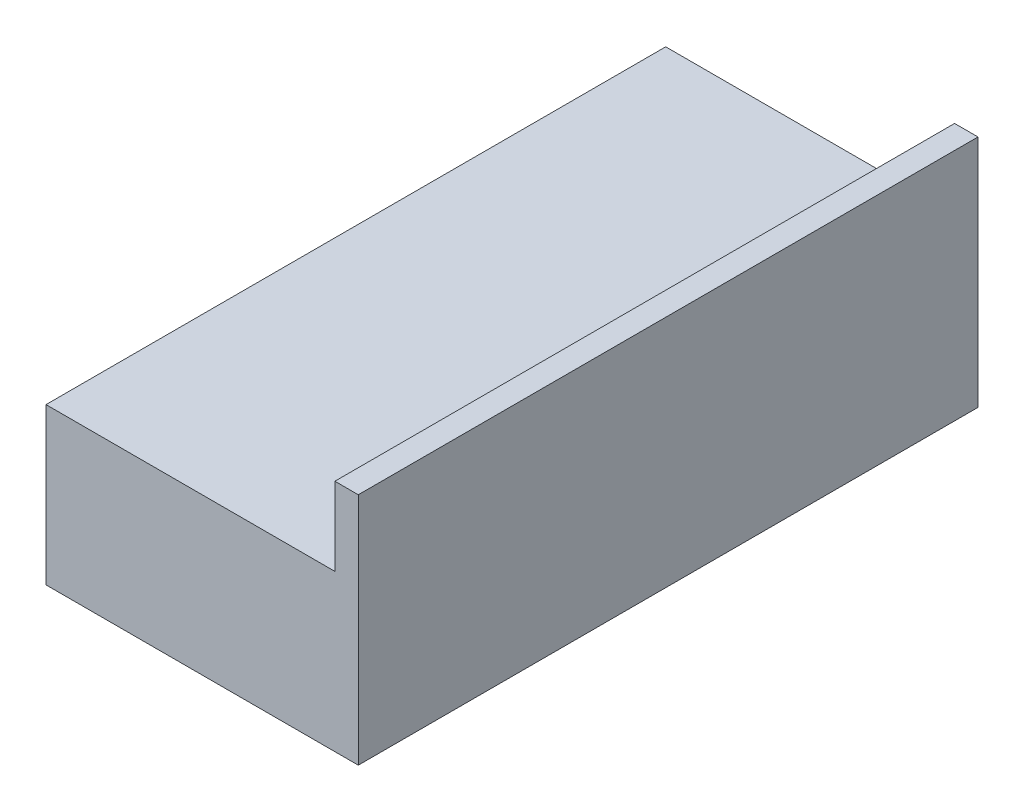
from build123d import *

# Parameters (mm, degrees)
BOSS_EXTRUDE1_DEPTH      = 39.6875
BOSS_EXTRUDE1_DEPTH_BACK = 39.6875


with BuildPart() as part:
    # Sketch1 → Boss-Extrude1 (new, two sides: drawn at the far end of the back side and taken through both)
    with BuildSketch(Plane.XY.offset(-BOSS_EXTRUDE1_DEPTH_BACK)):
        Polygon((-20, 10), (17, 10), (17, 20), (20, 20), (20, 10), (20, -10), (-20, -10), align=None)
    extrude(amount=BOSS_EXTRUDE1_DEPTH + BOSS_EXTRUDE1_DEPTH_BACK)


solid = part.part
